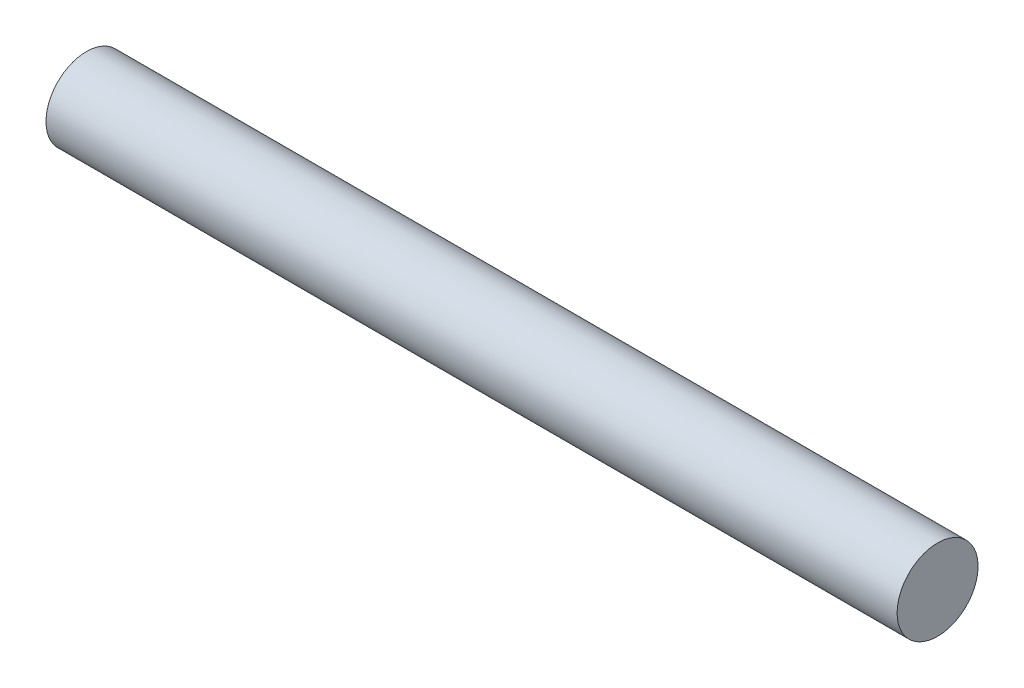
from build123d import *

# Parameters (mm, degrees)
SKETCH1_W = 534
SKETCH1_H = 25.4


with BuildPart() as part:
    # Sketch1 → Revolve1 (revolve)
    with BuildSketch(Plane.XY, mode=Mode.PRIVATE) as revolve1_sk:
        with Locations((267, 12.7)):
            Rectangle(SKETCH1_W, SKETCH1_H)
    revolve(revolve1_sk.sketch.rotate(Axis((-28.208709425, 0, 0), (1, 0, 0)), 90), axis=Axis((-28.208709425, 0, 0), (1, 0, 0)))


solid = part.part
